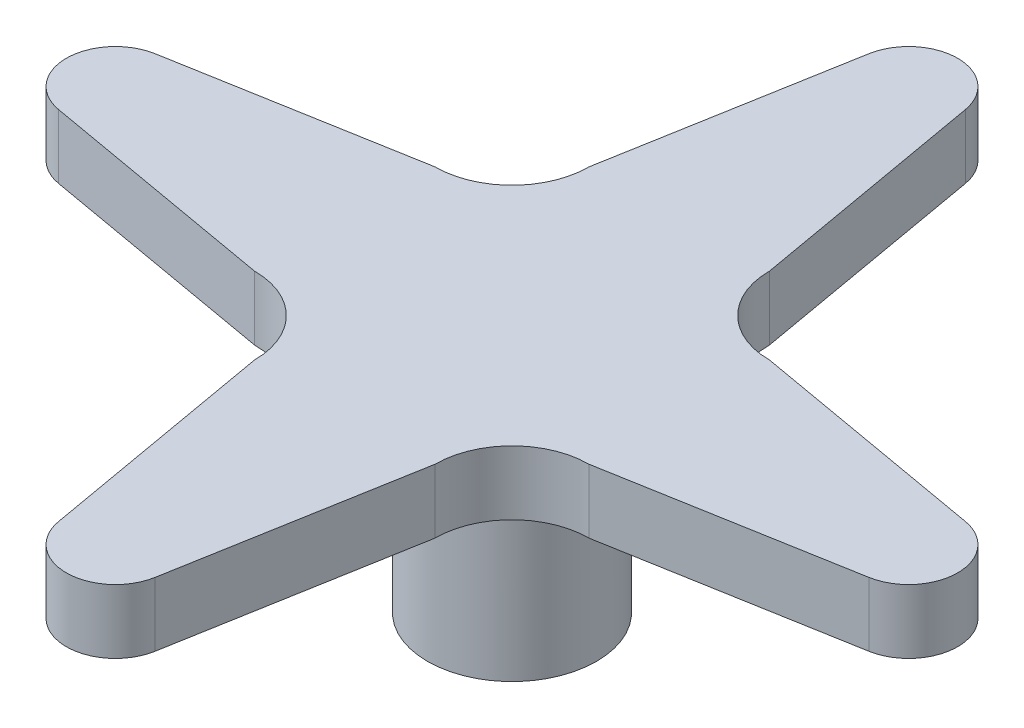
from build123d import *

# Parameters (mm, degrees)
BOSS_EXTRUDE1_DEPTH = 1.325
SKETCH5_R           = 3.5
BOSS_EXTRUDE4_DEPTH = 8
CUT_EXTRUDE1_DEPTH  = 8


with BuildPart() as part:
    # Sketch2 → Boss-Extrude1 (new, symmetric)
    with BuildSketch(Plane(origin=(0, 0, 0), x_dir=(1, 0, 0), z_dir=(0, 1, 0))):
        with BuildLine():
            Line((2, 16.771800738), (3.736481777, 6.923723208))
            ThreePointArc((3.736481777, 6.923723208), (3.979096084, 5.704018717), (4.670003178, 4.670003178))
            ThreePointArc((4.670003178, 4.670003178), (5.704018717, 3.979096084), (6.923723208, 3.736481777))
            Line((6.923723208, 3.736481777), (16.771800738, 2))
            ThreePointArc((16.771800738, 2), (18.45, 0), (16.771800738, -2))
            Line((16.771800738, -2), (6.923723208, -3.736481777))
            ThreePointArc((6.923723208, -3.736481777), (5.704018717, -3.979096084), (4.670003178, -4.670003178))
            ThreePointArc((4.670003178, -4.670003178), (3.979096084, -5.704018717), (3.736481777, -6.923723208))
            Line((3.736481777, -6.923723208), (2, -16.771800738))
            ThreePointArc((2, -16.771800738), (0, -18.45), (-2, -16.771800738))
            Line((-2, -16.771800738), (-3.736481777, -6.923723208))
            ThreePointArc((-3.736481777, -6.923723208), (-3.979096084, -5.704018717), (-4.670003178, -4.670003178))
            ThreePointArc((-4.670003178, -4.670003178), (-5.704018717, -3.979096084), (-6.923723208, -3.736481777))
            Line((-6.923723208, -3.736481777), (-16.771800738, -2))
            ThreePointArc((-16.771800738, -2), (-18.45, 0), (-16.771800738, 2))
            Line((-16.771800738, 2), (-6.923723208, 3.736481777))
            ThreePointArc((-6.923723208, 3.736481777), (-5.704018717, 3.979096084), (-4.670003178, 4.670003178))
            ThreePointArc((-4.670003178, 4.670003178), (-3.979096084, 5.704018717), (-3.736481777, 6.923723208))
            Line((-3.736481777, 6.923723208), (-2, 16.771800738))
            ThreePointArc((-2, 16.771800738), (0, 18.45), (2, 16.771800738))
        make_face()
    extrude(amount=BOSS_EXTRUDE1_DEPTH, both=True)

    # Sketch5 → Boss-Extrude4 (add)
    with BuildSketch(Plane.XZ.offset(1.325)):
        with Locations(Location((0, 0, 0), (0, 0, 90))):
            Circle(SKETCH5_R)
    extrude(amount=BOSS_EXTRUDE4_DEPTH)

    # Sketch6 → Cut-Extrude1 (cut)
    with BuildSketch(Plane.XZ.offset(9.325)):
        with BuildLine():
            ThreePointArc((2.075, 0), (-0.799143979, 1.91493966), (-1.459451952, -1.475))
            Line((-1.459451952, -1.475), (1.459451952, -1.475))
            ThreePointArc((1.459451952, -1.475), (1.91493966, -0.799143979), (2.075, 0))
        make_face()
    extrude(amount=-CUT_EXTRUDE1_DEPTH, mode=Mode.SUBTRACT)


solid = part.part
